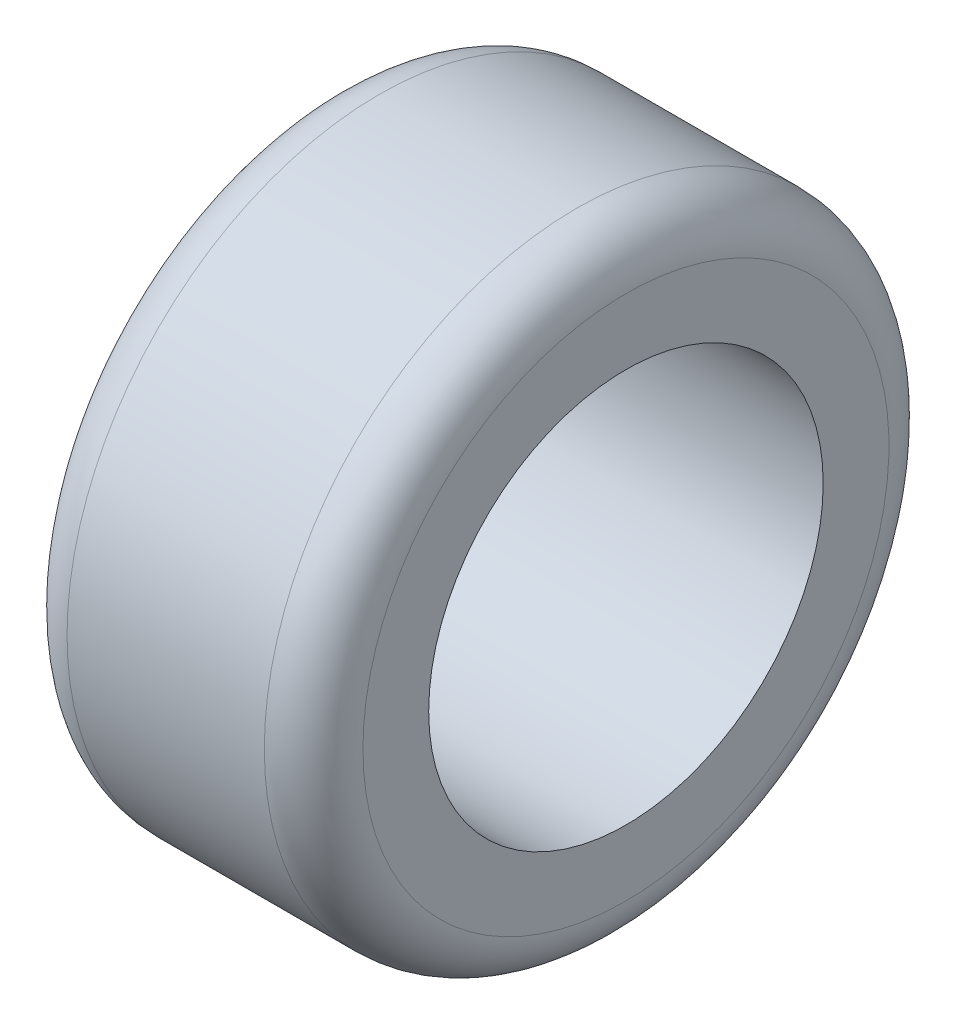
from build123d import *


with BuildPart() as part:
    # Эскиз1 → Повернуть1 (revolve)
    with BuildSketch(Plane.XY, mode=Mode.PRIVATE) as revolve_1_sk:
        with BuildLine():
            Line((-10.546122027, 12), (7.453877973, 12))
            Line((7.453877973, 12), (7.453877973, 16))
            ThreePointArc((7.453877973, 16), (6.575198317, 18.121320344), (4.453877973, 19))
            Line((4.453877973, 19), (-7.546122027, 19))
            ThreePointArc((-7.546122027, 19), (-9.66744237, 18.121320344), (-10.546122027, 16))
            Line((-10.546122027, 16), (-10.546122027, 12))
        make_face()
    revolve(revolve_1_sk.sketch.rotate(Axis((-38.283867632, 0, 0), (1, 0, 0)), 90), axis=Axis((-38.283867632, 0, 0), (1, 0, 0)))


solid = part.part
